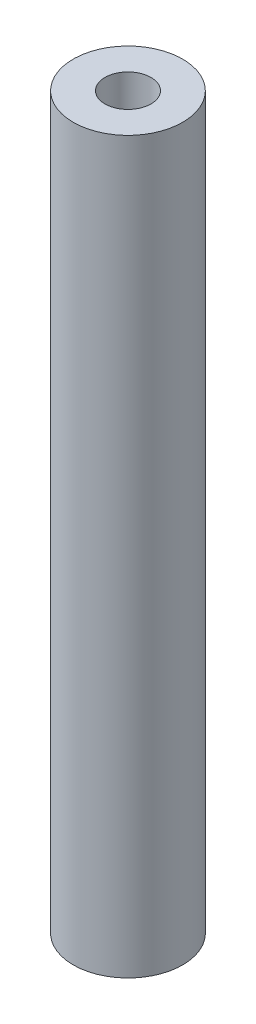
from build123d import *

# Parameters (mm, degrees)
SKETCH1_R           = 3.45
SKETCH1_R_2         = 1.45
BOSS_EXTRUDE1_DEPTH = 46


with BuildPart() as part:
    # Sketch1 → Boss-Extrude1 (new body)
    with BuildSketch(Plane(origin=(0, 0, 0), x_dir=(1, 0, 0), z_dir=(0, 1, 0))):
        with Locations(Location((0, 0, 0), (0, 0, 270))):
            Circle(SKETCH1_R)
        with Locations(Location((0, 0, 0), (0, 0, 270))):
            Circle(SKETCH1_R_2, mode=Mode.SUBTRACT)
    extrude(amount=BOSS_EXTRUDE1_DEPTH)


solid = part.part
